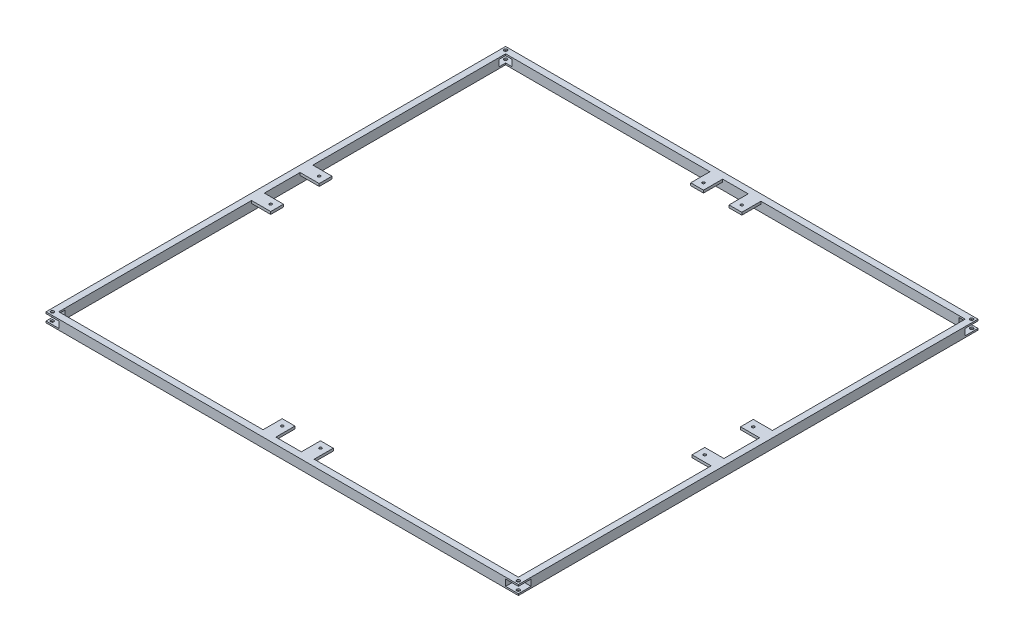
from build123d import *

# Parameters (mm, degrees)
SKETCH1_W           = 740
SKETCH1_H           = 720
SKETCH1_W_2         = 720
SKETCH1_H_2         = 700
BOSS_EXTRUDE1_DEPTH = 15
SKETCH2_R           = 2.5
CUT_EXTRUDE1_DEPTH  = 517.454257413
SKETCH3_W           = 20
SKETCH3_H           = 10
CUT_EXTRUDE2_DEPTH  = 20
SKETCH5_W           = 20
SKETCH5_H           = 10
CUT_EXTRUDE3_DEPTH  = 20
SKETCH6_W           = 20
SKETCH6_H           = 30
SKETCH6_W_2         = 30
SKETCH6_H_2         = 20
BOSS_EXTRUDE2_DEPTH = 4
SKETCH7_R           = 2
CUT_EXTRUDE4_DEPTH  = 4


with BuildPart() as part:
    # Sketch1 → Boss-Extrude1 (new body)
    with BuildSketch(Plane(origin=(0, 0, 0), x_dir=(1, 0, 0), z_dir=(0, 1, 0))):
        Rectangle(SKETCH1_W, SKETCH1_H)
        Rectangle(SKETCH1_W_2, SKETCH1_H_2, mode=Mode.SUBTRACT)
    extrude(amount=BOSS_EXTRUDE1_DEPTH)

    # Sketch2 → Cut-Extrude1 (cut, through all)
    with BuildSketch(Plane(origin=(0, 15, 0), x_dir=(1, 0, 0), z_dir=(0, 1, 0))):
        with Locations(Location((-365, 355, 0), (0, 0, 270))):
            Circle(SKETCH2_R)
        with Locations(Location((365, 355, 0), (0, 0, 270))):
            Circle(SKETCH2_R)
        with Locations(Location((365, -355, 0), (0, 0, 270))):
            Circle(SKETCH2_R)
        with Locations(Location((-365, -355, 0), (0, 0, 270))):
            Circle(SKETCH2_R)
    extrude(amount=-CUT_EXTRUDE1_DEPTH, mode=Mode.SUBTRACT)

    # Sketch3 → Cut-Extrude2 (cut)
    with BuildSketch(Plane.XY.offset(360)):
        with Locations((-360, 7.5)):
            Rectangle(SKETCH3_W, SKETCH3_H)
        with Locations((360, 7.5)):
            Rectangle(SKETCH3_W, SKETCH3_H)
    extrude(amount=-CUT_EXTRUDE2_DEPTH, mode=Mode.SUBTRACT)

    # Sketch5 → Cut-Extrude3 (cut)
    with BuildSketch(Plane(origin=(0, 0, -360), x_dir=(-1, 0, 0), z_dir=(0, 0, -1))):
        with Locations((-360, 7.5)):
            Rectangle(SKETCH5_W, SKETCH5_H)
        with Locations((360, 7.5)):
            Rectangle(SKETCH5_W, SKETCH5_H)
    extrude(amount=-CUT_EXTRUDE3_DEPTH, mode=Mode.SUBTRACT)

    # Sketch6 → Boss-Extrude2 (add)
    with BuildSketch(Plane(origin=(0, 15, 0), x_dir=(1, 0, 0), z_dir=(0, 1, 0))):
        with Locations((-30, 335)):
            Rectangle(SKETCH6_W, SKETCH6_H)
        with Locations((30, 335)):
            Rectangle(SKETCH6_W, SKETCH6_H)
        with Locations((30, -335)):
            Rectangle(SKETCH6_W, SKETCH6_H)
        with Locations((-30, -335)):
            Rectangle(SKETCH6_W, SKETCH6_H)
        with Locations((-345, -38)):
            Rectangle(SKETCH6_W_2, SKETCH6_H_2)
        with Locations((-345, 38)):
            Rectangle(SKETCH6_W_2, SKETCH6_H_2)
        with Locations((345, -38)):
            Rectangle(SKETCH6_W_2, SKETCH6_H_2)
        with Locations((345, 38)):
            Rectangle(SKETCH6_W_2, SKETCH6_H_2)
    extrude(amount=-BOSS_EXTRUDE2_DEPTH)

    # Sketch7 → Cut-Extrude4 (cut)
    with BuildSketch(Plane(origin=(0, 15, 0), x_dir=(1, 0, 0), z_dir=(0, 1, 0))):
        with Locations(Location((-30, 330, 0), (0, 0, 270))):
            Circle(SKETCH7_R)
        with Locations(Location((30, 330, 0), (0, 0, 90))):
            Circle(SKETCH7_R)
        with Locations(Location((30, -330, 0), (0, 0, 270))):
            Circle(SKETCH7_R)
        with Locations(Location((-30, -330, 0), (0, 0, 90))):
            Circle(SKETCH7_R)
        with Locations(Location((340, 38, 0), (0, 0, 270))):
            Circle(SKETCH7_R)
        with Locations(Location((340, -38, 0), (0, 0, 90))):
            Circle(SKETCH7_R)
        with Locations(Location((-340, -38, 0), (0, 0, 270))):
            Circle(SKETCH7_R)
        with Locations(Location((-340, 38, 0), (0, 0, 90))):
            Circle(SKETCH7_R)
    extrude(amount=-CUT_EXTRUDE4_DEPTH, mode=Mode.SUBTRACT)


solid = part.part
